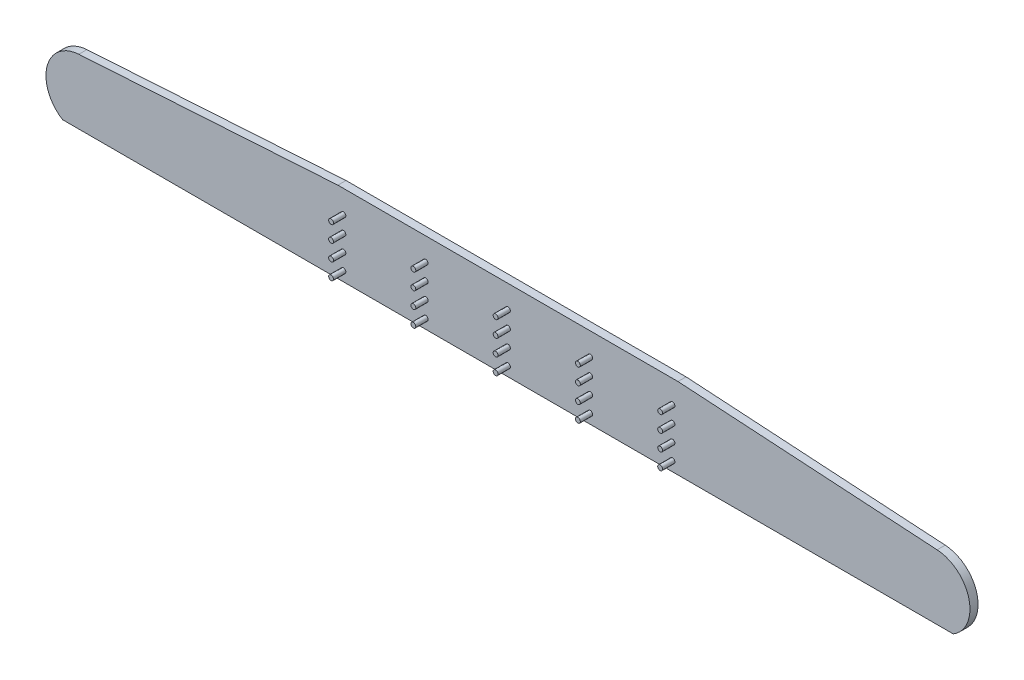
from build123d import *

# Parameters (mm, degrees)
SKETCH3_W           = 210
SKETCH3_H           = 50
BOSS_EXTRUDE1_DEPTH = 5
SKETCH8_R           = 1.5
BOSS_EXTRUDE2_DEPTH = 7.62


with BuildPart() as part:
    # Sketch3 → Boss-Extrude1 (new body)
    with BuildSketch(Plane.XY):
        Polygon((-265, -25), (-105, -25), (-105, 25), (-265, 15), align=None)
        with BuildLine():
            Line((-275, -25), (-265, -25))
            Line((-265, -25), (-265, 15))
            ThreePointArc((-265, 15), (-284.634416342, -1.341395914), (-275, -25))
        make_face()
        Rectangle(SKETCH3_W, SKETCH3_H)
        Polygon((105, 25), (105, -25), (265, -25), (265, 15), align=None)
        with BuildLine():
            Line((265, 15), (265, -25))
            Line((265, -25), (275, -25))
            ThreePointArc((275, -25), (284.634416342, -1.341395914), (265, 15))
        make_face()
    extrude(amount=BOSS_EXTRUDE1_DEPTH)

    # Sketch8 → Boss-Extrude2 (add)
    with BuildSketch(Plane.XY.offset(5)):
        with Locations((0, 11)):
            Circle(SKETCH8_R)
        with Locations((0, 1)):
            Circle(SKETCH8_R)
        with Locations((0, -9)):
            Circle(SKETCH8_R)
        with Locations((0, -19)):
            Circle(SKETCH8_R)
        with Locations((50.8, 11)):
            Circle(SKETCH8_R)
        with Locations((50.8, -9)):
            Circle(SKETCH8_R)
        with Locations((50.8, 1)):
            Circle(SKETCH8_R)
        with Locations((50.8, -19)):
            Circle(SKETCH8_R)
        with Locations((101.6, 11)):
            Circle(SKETCH8_R)
        with Locations((101.6, -9)):
            Circle(SKETCH8_R)
        with Locations((101.6, 1)):
            Circle(SKETCH8_R)
        with Locations((101.6, -19)):
            Circle(SKETCH8_R)
        with Locations((-50.8, 11)):
            Circle(SKETCH8_R)
        with Locations((-50.8, 1)):
            Circle(SKETCH8_R)
        with Locations((-50.8, -9)):
            Circle(SKETCH8_R)
        with Locations((-50.8, -19)):
            Circle(SKETCH8_R)
        with Locations((-101.6, 11)):
            Circle(SKETCH8_R)
        with Locations((-101.6, 1)):
            Circle(SKETCH8_R)
        with Locations((-101.6, -9)):
            Circle(SKETCH8_R)
        with Locations((-101.6, -19)):
            Circle(SKETCH8_R)
    extrude(amount=BOSS_EXTRUDE2_DEPTH)


solid = part.part
